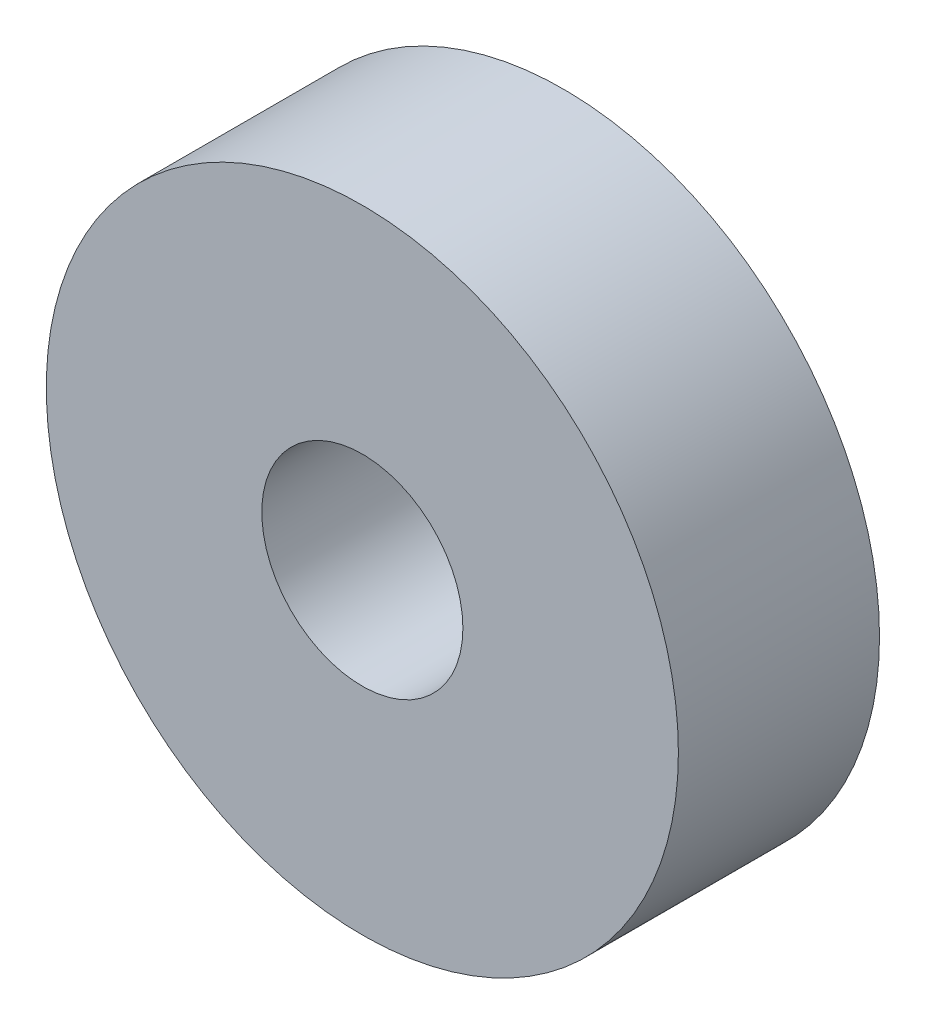
from build123d import *

# Parameters (mm, degrees)
SKETCH1_R           = 11
SKETCH1_R_2         = 3.5
BOSS_EXTRUDE1_DEPTH = 3.5


with BuildPart() as part:
    # Sketch1 → Boss-Extrude1 (new, symmetric)
    with BuildSketch(Plane.XY):
        Circle(SKETCH1_R)
        Circle(SKETCH1_R_2, mode=Mode.SUBTRACT)
    extrude(amount=BOSS_EXTRUDE1_DEPTH, both=True)


solid = part.part
